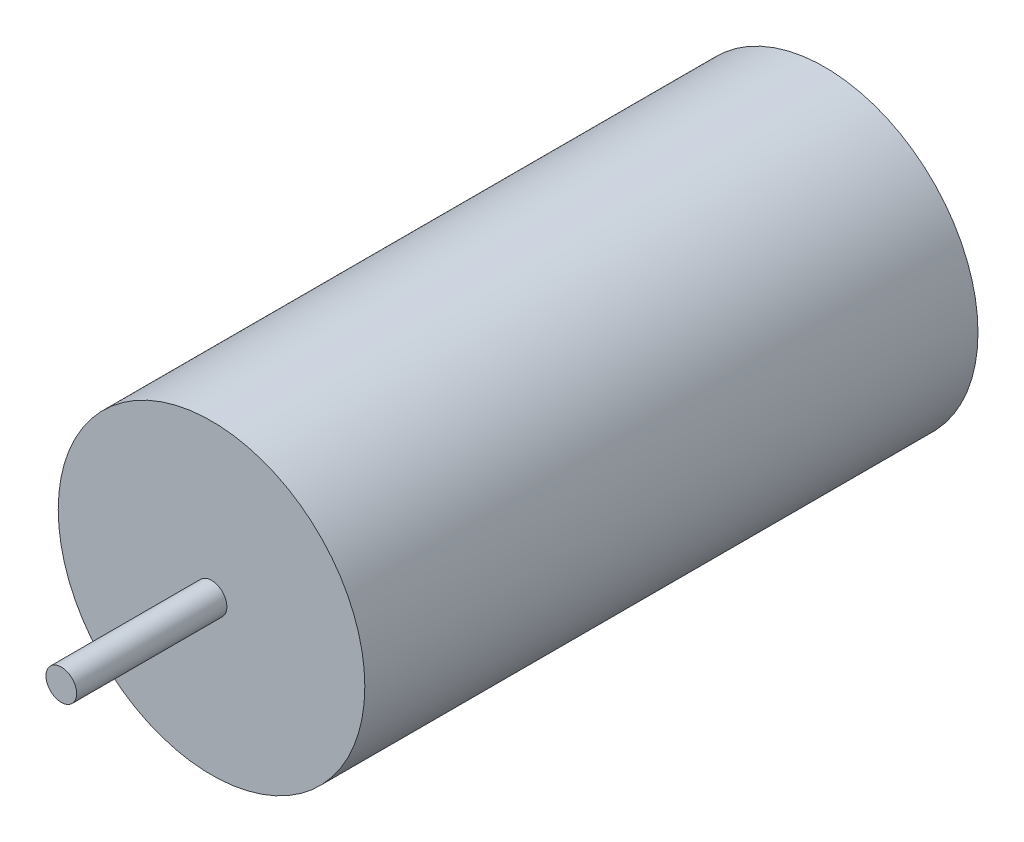
from build123d import *

# Parameters (mm, degrees)
SKETCH1_R           = 10
BOSS_EXTRUDE1_DEPTH = 40
SKETCH2_R           = 1
BOSS_EXTRUDE2_DEPTH = 9.8


with BuildPart() as part:
    # Sketch1 → Boss-Extrude1 (new body)
    with BuildSketch(Plane.XY):
        Circle(SKETCH1_R)
    extrude(amount=BOSS_EXTRUDE1_DEPTH)

    # Sketch2 → Boss-Extrude2 (add)
    with BuildSketch(Plane.XY.offset(40)):
        Circle(SKETCH2_R)
    extrude(amount=BOSS_EXTRUDE2_DEPTH)


solid = part.part
